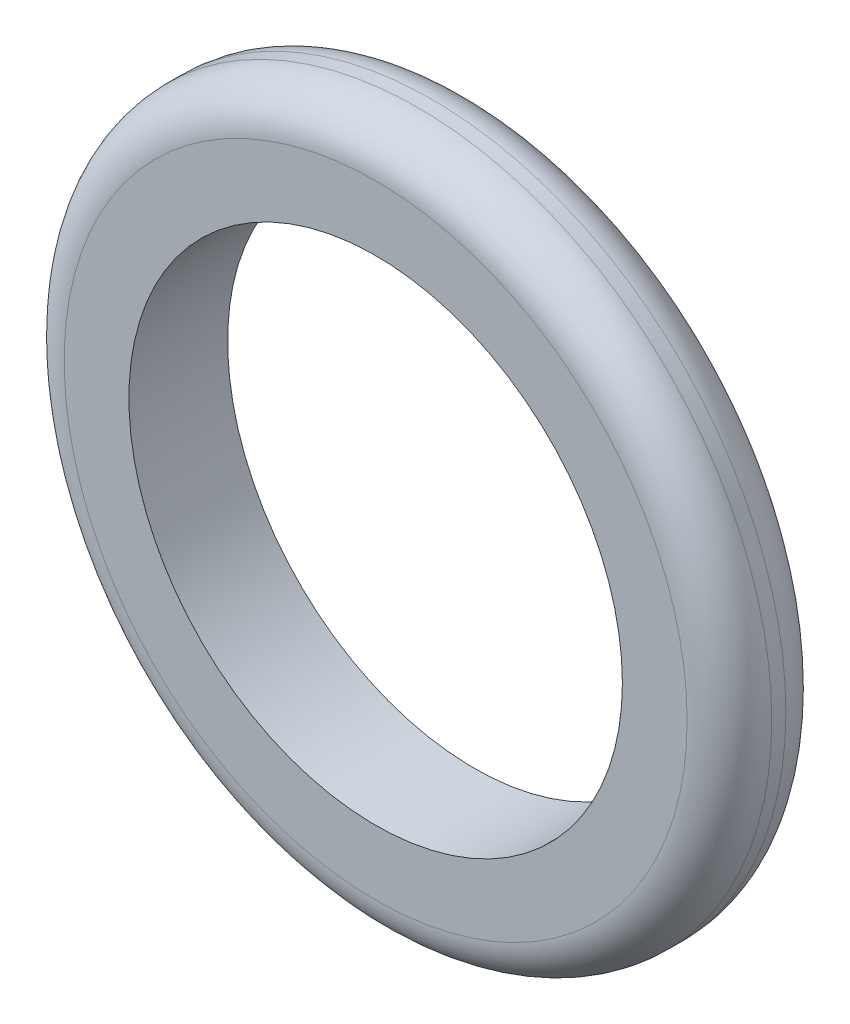
from build123d import *

# Parameters (mm, degrees)
SKETCH1_R           = 250.932647595
BOSS_EXTRUDE1_DEPTH = 35
FILLET1_R           = 30
SKETCH2_R           = 175
CUT_EXTRUDE1_DEPTH  = 70


with BuildPart() as part:
    # Sketch1 → Boss-Extrude1 (new, symmetric)
    with BuildSketch(Plane.XY):
        with Locations((0, -38.296576895)):
            Circle(SKETCH1_R)
    extrude(amount=BOSS_EXTRUDE1_DEPTH, both=True)

    # Fillet1
    fillet1_edges = [part.edges().sort_by_distance(p)[0] for p in [
        (-250.932647595, -38.296576895, -35),
        (-250.932647595, -38.296576895, 35),
    ]]
    fillet(fillet1_edges, radius=FILLET1_R)

    # Sketch2 → Cut-Extrude1 (cut)
    with BuildSketch(Plane.XY.offset(35)):
        with Locations((0, -38.296576895)):
            Circle(SKETCH2_R)
    extrude(amount=-CUT_EXTRUDE1_DEPTH, mode=Mode.SUBTRACT)


solid = part.part
